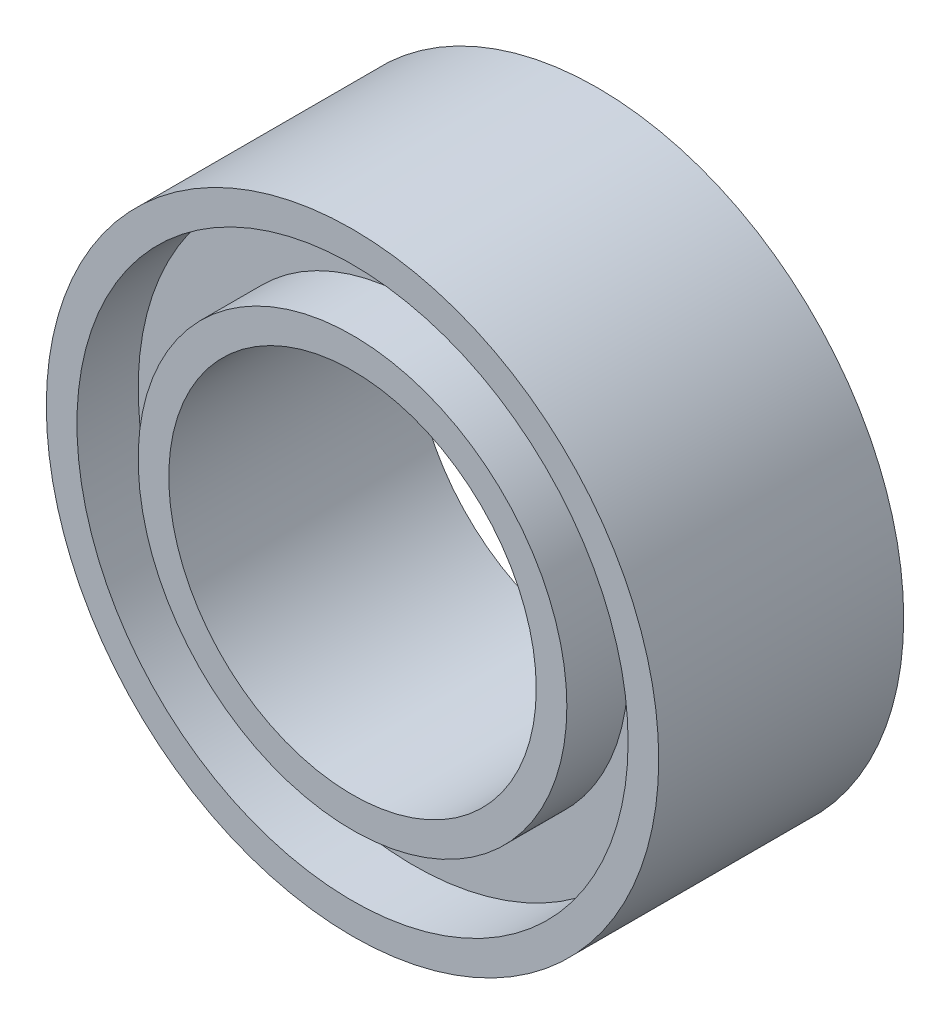
from build123d import *

# Parameters (mm, degrees)
SKETCH_1_R          = 5
SKETCH_1_R_2        = 3
EXTRUDE_1_DEPTH     = 4
SKETCH_2_R          = 4.5
SKETCH_2_R_2        = 3.5
CUT_EXTRUDE_1_DEPTH = 1
CUT_EXTRUDE_START   = -1
SKETCH_3_R          = 4.5
SKETCH_3_R_2        = 3.5
CUT_EXTRUDE_2_DEPTH = 1


with BuildPart() as part:
    # 草图1 → 凸台-拉伸1 (new body)
    with BuildSketch(Plane.XY):
        Circle(SKETCH_1_R)
        Circle(SKETCH_1_R_2, mode=Mode.SUBTRACT)
    extrude(amount=EXTRUDE_1_DEPTH)

    # 草图2 → 切除-拉伸1 (cut)
    with BuildSketch(Plane.XY.offset(4)):
        Circle(SKETCH_2_R)
        Circle(SKETCH_2_R_2, mode=Mode.SUBTRACT)
    extrude(amount=-CUT_EXTRUDE_1_DEPTH, mode=Mode.SUBTRACT)

    # 草图3 → 切除-拉伸2 (cut)
    with BuildSketch(Plane(origin=(0, 0, 0), x_dir=(-1, 0, 0), z_dir=(0, 0, -1)).offset(CUT_EXTRUDE_START)):
        with Locations(Location((0, 0, 0), (0, 0, 180))):
            Circle(SKETCH_3_R)
        with Locations(Location((0, 0, 0), (0, 0, 180))):
            Circle(SKETCH_3_R_2, mode=Mode.SUBTRACT)
    extrude(amount=CUT_EXTRUDE_2_DEPTH, mode=Mode.SUBTRACT)


solid = part.part
